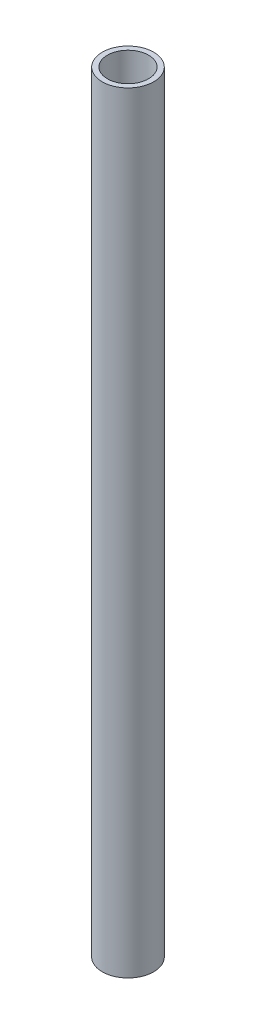
from build123d import *

# Parameters (mm, degrees)
ESQUISSE1_R        = 5
ESQUISSE1_R_2      = 4
BOSS_EXTRU_1_DEPTH = 150


with BuildPart() as part:
    # Esquisse1 → Boss.-Extru.1 (new body)
    with BuildSketch(Plane(origin=(0, 0, 0), x_dir=(1, 0, 0), z_dir=(0, 1, 0))):
        with Locations(Location((0, 0, 0), (0, 0, 270))):
            Circle(ESQUISSE1_R)
        with Locations(Location((0, 0, 0), (0, 0, 270))):
            Circle(ESQUISSE1_R_2, mode=Mode.SUBTRACT)
    extrude(amount=BOSS_EXTRU_1_DEPTH)


solid = part.part
